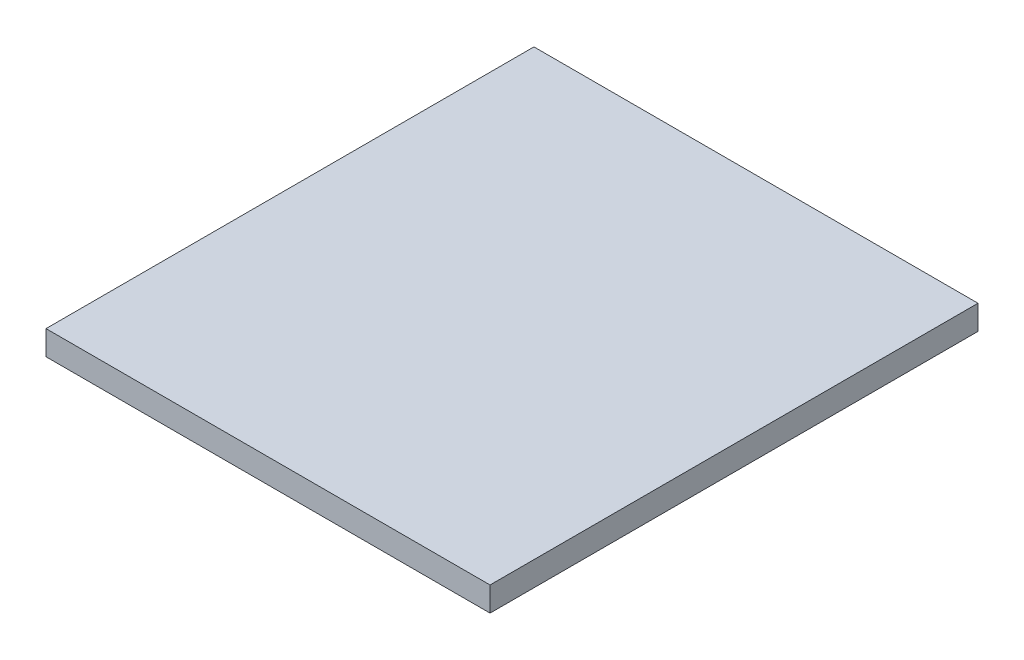
from build123d import *

# Parameters (mm, degrees)
CROQUIS1_W              = 91
CROQUIS1_H              = 100
SALIENTE_EXTRUIR1_DEPTH = 5


with BuildPart() as part:
    # Croquis1 → Saliente-Extruir1 (new body)
    with BuildSketch(Plane(origin=(0, 0, 0), x_dir=(1, 0, 0), z_dir=(0, 1, 0))):
        Rectangle(CROQUIS1_W, CROQUIS1_H)
    extrude(amount=SALIENTE_EXTRUIR1_DEPTH)


solid = part.part
